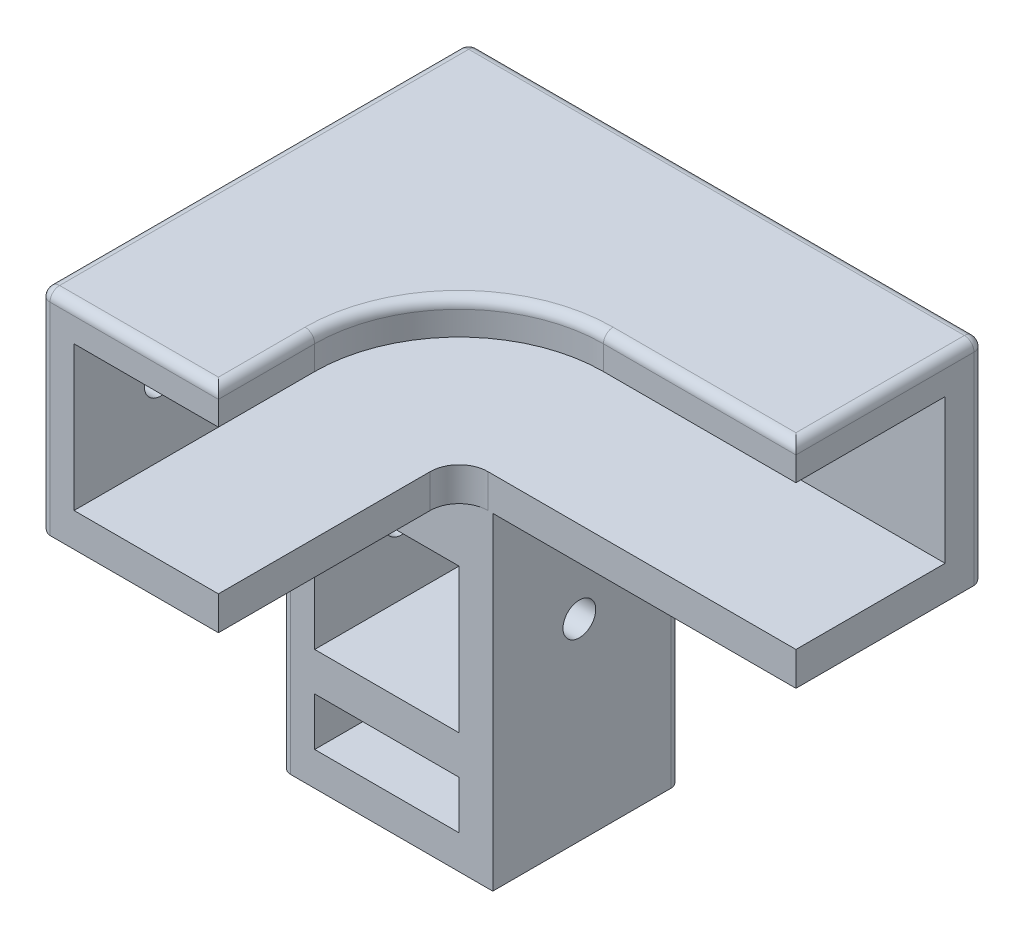
from build123d import *

# Parameters (mm, degrees)
BOSS_EXTRUDE1_DEPTH  = 19.5
SKETCH3_W            = 18.5
SKETCH3_H            = 22
BOSS_EXTRUDE2_DEPTH  = 25
SKETCH5_W            = 50
SKETCH5_H            = 15
SKETCH5_W_2          = 15
SKETCH5_H_2          = 5
CUT_EXTRUDE1_DEPTH   = 40.5
BOSS_EXTRUDE4_DEPTH  = 3.5
BOSS_EXTRUDE5_DEPTH  = 3.5
BOSS_EXTRUDE6_DEPTH  = 3.5
FILLET3_R            = 3
CUT_EXTRUDE3_DEPTH   = 1
SKETCH12_R           = 1.7
CUT_EXTRUDE4_DEPTH   = 5
SKETCH13_R           = 1.7
CUT_EXTRUDE5_DEPTH   = 45
SKETCH14_R           = 1.7
CUT_EXTRUDE6_DEPTH   = 45
SKETCH15_R           = 1.7
CUT_EXTRUDE7_DEPTH   = 4
FILLET3_OF_MIRROR2_R = 3
SKETCH16_W           = 70.294928241
SKETCH16_H           = 57.866283398
CUT_EXTRUDE8_DEPTH   = 72
FILLET4_R            = 1


with BuildPart() as part:
    # Sketch1 → Boss-Extrude1 (new body)
    with BuildSketch(Plane.XY):
        Polygon((-5.699410772, 32.916253451), (16.300589228, 32.916253451), (16.300589228, -23.083746549), (-5.699410772, -23.083746549), (-5.699410772, 10.916253451), (-37.199410772, 10.916253451), (-37.199410772, 32.916253451), align=None)
    boss_extrude1 = extrude(amount=BOSS_EXTRUDE1_DEPTH)

    # Sketch3 → Boss-Extrude2 (add)
    with BuildSketch(Plane.XY.offset(19.5)):
        with Locations((7.050589228, 21.916253451)):
            Rectangle(SKETCH3_W, SKETCH3_H)
    boss_extrude2 = extrude(amount=BOSS_EXTRUDE2_DEPTH)

    # Sketch5 → Cut-Extrude1 (cut)
    with BuildSketch(Plane.XY.offset(44.5)):
        with Locations((-12.199410772, 21.916253451)):
            Rectangle(SKETCH5_W, SKETCH5_H)
        with Locations((5.300589228, -3.083746549)):
            Rectangle(SKETCH5_W_2, SKETCH5_H)
        with Locations((5.300589228, -17.083746549)):
            Rectangle(SKETCH5_W_2, SKETCH5_H_2)
    cut_extrude1 = extrude(amount=-CUT_EXTRUDE1_DEPTH, mode=Mode.SUBTRACT)

    # Sketch7 → Boss-Extrude4 (add)
    with BuildSketch(Plane(origin=(16.300589228, 0, 0), x_dir=(0, 0, -1), z_dir=(1, 0, 0))):
        with BuildLine():
            Line((-34.5, 10.916253451), (-19.5, 10.916253451))
            Line((-19.5, 10.916253451), (-19.5, -4.083746549))
            ThreePointArc((-19.5, -4.083746549), (-23.893398282, 6.522855169), (-34.5, 10.916253451))
        make_face()
    boss_extrude4 = extrude(amount=-BOSS_EXTRUDE4_DEPTH)

    # Sketch8 → Boss-Extrude5 (add)
    with BuildSketch(Plane(origin=(0, 0, 0), x_dir=(-1, 0, 0), z_dir=(0, 0, -1))):
        with BuildLine():
            Line((5.699410772, 10.916253451), (20.699410772, 10.916253451))
            ThreePointArc((20.699410772, 10.916253451), (10.092809055, 6.522855169), (5.699410772, -4.083746549))
            Line((5.699410772, -4.083746549), (5.699410772, 10.916253451))
        make_face()
    boss_extrude5 = extrude(amount=-BOSS_EXTRUDE5_DEPTH)

    # Sketch9 → Boss-Extrude6 (add)
    with BuildSketch(Plane(origin=(0, 32.916253451, 0), x_dir=(1, 0, 0), z_dir=(0, 1, 0))):
        with BuildLine():
            Line((-2.199410772, -34.5), (-2.199410772, -19.5))
            Line((-2.199410772, -19.5), (-17.199410772, -19.5))
            ThreePointArc((-17.199410772, -19.5), (-6.592809055, -23.893398282), (-2.199410772, -34.5))
        make_face()
    boss_extrude6 = extrude(amount=-BOSS_EXTRUDE6_DEPTH)

    # Fillet3
    fillet3_edges = [part.edges().sort_by_distance(p)[0] for p in [
        (-2.199410772, 12.666253451, 19.5),
    ]]
    fillet(fillet3_edges, radius=FILLET3_R)

    # Sketch11 → Cut-Extrude3 (cut)
    # profile 1 of 4: a face of its own
    with BuildSketch(Plane(origin=(0, 0, 0), x_dir=(-1, 0, 0), z_dir=(0, 0, -1))):
        Polygon((-10.800589228, -18.789996549), (-10.800589228, -16.838073472), (-2.43039692, -14.652977318), (-10.800589228, -12.463073472), (-10.800589228, -10.515958087), (1.199410772, -8.729900395), (1.199410772, -10.602496549), (-6.379916151, -11.729900395), (1.199410772, -13.715477318), (1.199410772, -15.597688857), (-6.379916151, -17.576054241), (1.199410772, -18.703458087), (1.199410772, -20.576054241), align=None)
    # profile 2 of 4: a face of its own
    with BuildSketch(Plane(origin=(0, 0, 0), x_dir=(-1, 0, 0), z_dir=(0, 0, -1))):
        with BuildLine():
            Line((-10.800589228, -7.991438857), (-10.800589228, -5.952977318))
            add(Edge.make_bspline(
                [(-10.800589228, -5.952977318), (-10.800005012, -5.818337024), (-10.798881276, -5.559357226), (-10.780939362, -5.185841664), (-10.756194453, -4.841644627), (-10.717588986, -4.528141475), (-10.670910939, -4.244422827), (-10.610297955, -3.991812577), (-10.542991354, -3.767135176), (-10.432899575, -3.510089545), (-10.261344606, -3.2204116), (-9.993854575, -2.916502166), (-9.674999978, -2.642644015), (-9.298421338, -2.412342144), (-8.876833149, -2.221736808), (-8.412796045, -2.089022583), (-7.914245505, -2.00467731), (-7.569376461, -1.995936272), (-7.391935381, -1.991438857)],
                knots=[0, 0, 0, 0, 1.067446855, 2.053227611, 2.964447842, 3.802928181, 4.55705831, 5.242813606, 5.861740442, 6.41401137, 7.456762865, 8.515266784, 9.610284097, 10.777391769, 12.003071174, 13.267653188, 14.594160368, 16, 16, 16, 16], degree=3))
            add(Edge.make_bspline(
                [(-7.391935381, -1.991438857), (-7.297355032, -1.992855248), (-7.111944506, -1.99563187), (-6.839545611, -2.016474255), (-6.57922187, -2.056818659), (-6.329385024, -2.104637483), (-6.092864844, -2.173393793), (-5.86736032, -2.254741183), (-5.654862929, -2.353204183), (-5.453365078, -2.465039747), (-5.262464902, -2.588608019), (-5.086843378, -2.732896484), (-4.9205107, -2.888692529), (-4.766123648, -3.059365613), (-4.626046251, -3.246963608), (-4.496602326, -3.448494847), (-4.377999142, -3.665222723), (-4.310704173, -3.817832702), (-4.276550766, -3.895285011)],
                knots=[0, 0, 0, 0, 1.163181294, 2.28024169, 3.356120165, 4.401649984, 5.406013808, 6.381787017, 7.347406326, 8.282525473, 9.21452408, 10.139462981, 11.073595085, 12.01554303, 12.965498088, 13.949545959, 14.959357709, 16, 16, 16, 16], degree=3))
            Line((-4.276550766, -3.895285011), (1.199410772, -1.452977318))
            Line((1.199410772, -1.452977318), (1.199410772, -3.541919626))
            Line((1.199410772, -3.541919626), (-4.031358458, -5.873650395))
            Line((-4.031358458, -5.873650395), (-4.031358458, -6.145285011))
            Line((-4.031358458, -6.145285011), (1.199410772, -6.145285011))
            Line((1.199410772, -6.145285011), (1.199410772, -7.991438857))
            Line((1.199410772, -7.991438857), (-10.800589228, -7.991438857))
        make_face()
        with BuildLine():
            Line((-6.185204612, -6.145285011), (-6.185204612, -5.515477318))
            add(Edge.make_bspline(
                [(-6.185204612, -5.515477318), (-6.186367141, -5.438550003), (-6.188596807, -5.291007573), (-6.198784481, -5.078941418), (-6.223636793, -4.886497292), (-6.255016899, -4.712471663), (-6.291026717, -4.555276318), (-6.342625913, -4.418389599), (-6.399049431, -4.298462814), (-6.489896288, -4.166118437), (-6.633796999, -4.027471922), (-6.856716063, -3.91397639), (-7.124487444, -3.84724369), (-7.317795964, -3.840947182), (-7.420781535, -3.837592703)],
                knots=[0, 0, 0, 0, 1.14443165, 2.194958024, 3.155864406, 4.02787753, 4.825710302, 5.549708663, 6.200008757, 6.791751392, 7.929772656, 9.129352395, 10.470655706, 12, 12, 12, 12], degree=3))
            add(Edge.make_bspline(
                [(-7.420781535, -3.837592703), (-7.484265153, -3.839856392), (-7.607360624, -3.844245712), (-7.785755229, -3.879686188), (-7.952879051, -3.933201989), (-8.103735349, -4.014031264), (-8.239800846, -4.109799367), (-8.356212547, -4.223260262), (-8.450592564, -4.353040951), (-8.531146795, -4.502587927), (-8.586059735, -4.694350085), (-8.620716321, -4.939833657), (-8.644326337, -5.246603017), (-8.645891807, -5.472154526), (-8.646743074, -5.594804241)],
                knots=[0, 0, 0, 0, 0.9241003, 1.791841178, 2.640927318, 3.471185814, 4.274581995, 5.058835706, 5.827024317, 6.605084504, 7.520888769, 8.714677486, 10.213517293, 12, 12, 12, 12], degree=3))
            Line((-8.646743074, -5.594804241), (-8.646743074, -6.145285011))
            Line((-8.646743074, -6.145285011), (-6.185204612, -6.145285011))
        make_face(mode=Mode.SUBTRACT)
    # profile 3 of 4: a face of its own
    with BuildSketch(Plane(origin=(0, 0, 0), x_dir=(-1, 0, 0), z_dir=(0, 0, -1))):
        with BuildLine():
            add(Edge.make_bspline(
                [(-1.262127689, -0.176054241), (-1.257647984, -0.104101941), (-1.248753835, 0.038754448), (-1.172545764, 0.242235867), (-1.05033496, 0.427832621), (-0.88404186, 0.590235666), (-0.687299125, 0.730105266), (-0.462023761, 0.828247267), (-0.217504351, 0.891566147), (-0.046993635, 0.897708021), (0.040756926, 0.900868836)],
                knots=[0, 0, 0, 0, 0.919349048, 1.825304879, 2.744940427, 3.746623331, 4.786044724, 5.819977252, 6.878086821, 8, 8, 8, 8], degree=3))
            add(Edge.make_bspline(
                [(0.040756926, 0.900868836), (0.128481887, 0.897613897), (0.299721778, 0.891260229), (0.545324854, 0.828809783), (0.771582895, 0.729449747), (0.970335119, 0.590396057), (1.138671939, 0.427821465), (1.264004419, 0.242957175), (1.339760461, 0.038678283), (1.348736151, -0.104127453), (1.353256926, -0.176054241)],
                knots=[0, 0, 0, 0, 1.117536417, 2.181440851, 3.211339843, 4.255104211, 5.260135653, 6.181815925, 7.084237479, 8, 8, 8, 8], degree=3))
            add(Edge.make_bspline(
                [(1.353256926, -0.176054241), (1.348770157, -0.248001687), (1.339861983, -0.390848436), (1.263364391, -0.595455675), (1.139460356, -0.781986068), (0.970956709, -0.945114294), (0.77080448, -1.081189928), (0.54542444, -1.181069939), (0.299695058, -1.243328016), (0.128472836, -1.249708594), (0.040756926, -1.252977318)],
                knots=[0, 0, 0, 0, 0.915447906, 1.817559426, 2.747445231, 3.752131388, 4.789763433, 5.819308596, 6.882847519, 8, 8, 8, 8], degree=3))
            add(Edge.make_bspline(
                [(0.040756926, -1.252977318), (-0.046984438, -1.249802679), (-0.217477284, -1.243633944), (-0.462123928, -1.180506316), (-0.686511891, -1.081845741), (-0.884668075, -0.944947749), (-1.051117925, -0.781983335), (-1.171904853, -0.594743665), (-1.248854997, -0.390923093), (-1.257681869, -0.248026694), (-1.262127689, -0.176054241)],
                knots=[0, 0, 0, 0, 1.121525552, 2.179269538, 3.212844836, 4.246063491, 5.247400307, 6.175325774, 7.080968592, 8, 8, 8, 8], degree=3))
        make_face()
    # profile 4 of 4: a face of its own
    with BuildSketch(Plane(origin=(0, 0, 0), x_dir=(-1, 0, 0), z_dir=(0, 0, -1))):
        with BuildLine():
            Line((-7.877512305, 3.639330374), (-7.877512305, 1.793176528))
            add(Edge.make_bspline(
                [(-7.877512305, 1.793176528), (-7.985104597, 1.806156245), (-8.194919789, 1.831467926), (-8.50062502, 1.89307865), (-8.789725475, 1.969009097), (-9.063857289, 2.060670567), (-9.32041803, 2.168002956), (-9.560895844, 2.292709709), (-9.787587098, 2.42930416), (-9.925017131, 2.537709574), (-9.99289692, 2.591253451)],
                knots=[0, 0, 0, 0, 1.13409845, 2.211599726, 3.261451197, 4.261463951, 5.235132031, 6.169264622, 7.095758548, 8, 8, 8, 8], degree=3))
            add(Edge.make_bspline(
                [(-9.99289692, 2.591253451), (-10.082013161, 2.667910273), (-10.256359415, 2.817881026), (-10.483761061, 3.07110519), (-10.676767562, 3.337669411), (-10.835123876, 3.619879277), (-10.958228421, 3.915924445), (-11.044683072, 4.227572925), (-11.099664631, 4.553240287), (-11.10537913, 4.776126179), (-11.108281535, 4.889330374)],
                knots=[0, 0, 0, 0, 1.065406432, 2.084352066, 3.078868942, 4.045367136, 5.013203651, 5.979674514, 6.9738726, 8, 8, 8, 8], degree=3))
            add(Edge.make_bspline(
                [(-11.108281535, 4.889330374), (-11.105554752, 4.990429502), (-11.100204953, 5.188780494), (-11.056686246, 5.480236578), (-10.97985421, 5.757907044), (-10.8818086, 6.026068289), (-10.745230943, 6.277428113), (-10.587175591, 6.520140361), (-10.396186865, 6.748620977), (-10.177194209, 6.959885993), (-9.943110555, 7.156839202), (-9.690759412, 7.324416021), (-9.43059281, 7.47074821), (-9.157422302, 7.588703888), (-8.873189212, 7.680392593), (-8.578388089, 7.744054748), (-8.273858918, 7.787935844), (-8.06677444, 7.791411893), (-7.96164692, 7.793176528)],
                knots=[0, 0, 0, 0, 1.018635126, 1.998506719, 2.96030997, 3.918683232, 4.868719089, 5.836268132, 6.834011598, 7.861887245, 8.899958098, 9.91230014, 10.909978245, 11.904579616, 12.905650751, 13.91466998, 14.941371293, 16, 16, 16, 16], degree=3))
            add(Edge.make_bspline(
                [(-7.96164692, 7.793176528), (-7.831571704, 7.7882504), (-7.575267724, 7.778543815), (-7.199658116, 7.710806724), (-6.842854452, 7.593710225), (-6.50564623, 7.43251906), (-6.191993909, 7.228071619), (-5.907939838, 6.979968911), (-5.654954295, 6.689672154), (-5.517272776, 6.469896674), (-5.447223843, 6.358080374)],
                knots=[0, 0, 0, 0, 1.027701034, 2.025011931, 3.004147813, 3.986880317, 4.970346872, 5.953160964, 6.958619193, 8, 8, 8, 8], degree=3))
            add(Edge.make_bspline(
                [(-5.447223843, 6.358080374), (-5.418934484, 6.430798423), (-5.362819656, 6.575042087), (-5.255412748, 6.779194324), (-5.134751997, 6.973329501), (-4.999067172, 7.154540458), (-4.847347238, 7.322970358), (-4.681616094, 7.478791827), (-4.500395305, 7.624150933), (-4.30375287, 7.755244697), (-4.095176448, 7.873355347), (-3.875726079, 7.97347104), (-3.648685489, 8.060719415), (-3.412791492, 8.133216192), (-3.166864793, 8.188590605), (-2.911254324, 8.225884056), (-2.647259211, 8.251365722), (-2.468118928, 8.253589988), (-2.377512305, 8.254714989)],
                knots=[0, 0, 0, 0, 0.971157749, 1.926390409, 2.867917292, 3.816032967, 4.741824403, 5.6878893, 6.646452846, 7.631864642, 8.628382992, 9.628642509, 10.633224323, 11.656081692, 12.699617594, 13.76949873, 14.871843985, 16, 16, 16, 16], degree=3))
            add(Edge.make_bspline(
                [(-2.377512305, 8.254714989), (-2.244325252, 8.252503818), (-1.981850533, 8.248146212), (-1.597044081, 8.197009582), (-1.226862615, 8.122689872), (-0.874542963, 8.009706698), (-0.536107314, 7.870492658), (-0.212201339, 7.699845341), (0.092892066, 7.493753909), (0.380575775, 7.261849568), (0.643411265, 7.006428676), (0.8765742, 6.732895346), (1.069672671, 6.437585756), (1.23223783, 6.128720843), (1.355158488, 5.799574581), (1.443839147, 5.455657192), (1.498563993, 5.093806224), (1.504216675, 4.847057422), (1.50710308, 4.721061143)],
                knots=[0, 0, 0, 0, 1.08934669, 2.146800001, 3.171892192, 4.175766193, 5.1695646, 6.164076811, 7.166278581, 8.178196077, 9.184573215, 10.16196427, 11.113242845, 12.066531174, 13.012937118, 13.981620827, 14.969363733, 16, 16, 16, 16], degree=3))
            add(Edge.make_bspline(
                [(1.50710308, 4.721061143), (1.504031919, 4.602279119), (1.498005885, 4.36921268), (1.44571629, 4.02762683), (1.362713421, 3.702437153), (1.243881772, 3.394298005), (1.091092441, 3.104692046), (0.906771997, 2.829859086), (0.687442467, 2.57259779), (0.434322499, 2.3350891), (0.15282569, 2.119255522), (-0.153407037, 1.926340908), (-0.483775783, 1.75924538), (-0.840338868, 1.624378739), (-1.217591782, 1.506817115), (-1.621739126, 1.421885121), (-2.049128635, 1.361769677), (-2.342880764, 1.341824077), (-2.49289692, 1.331638066)],
                knots=[0, 0, 0, 0, 0.974003266, 1.911126485, 2.827923683, 3.722775623, 4.613731572, 5.50894563, 6.432318302, 7.38099101, 8.351349308, 9.338047726, 10.346428225, 11.382873954, 12.462111462, 13.585146545, 14.766759469, 16, 16, 16, 16], degree=3))
            Line((-2.49289692, 1.331638066), (-2.49289692, 3.177791913))
            add(Edge.make_bspline(
                [(-2.49289692, 3.177791913), (-2.417425318, 3.188945376), (-2.270574462, 3.210647521), (-2.058705359, 3.256683558), (-1.861732034, 3.311165199), (-1.680044741, 3.376135049), (-1.514279405, 3.45120486), (-1.360798784, 3.532148117), (-1.223710633, 3.625749249), (-1.065384613, 3.762941693), (-0.896220111, 3.953356149), (-0.749458771, 4.217045491), (-0.662515335, 4.51137642), (-0.652102457, 4.7164657), (-0.646743074, 4.822022682)],
                knots=[0, 0, 0, 0, 1.004083628, 1.953722164, 2.852062002, 3.692886634, 4.490800013, 5.245942238, 5.974461452, 6.670088602, 8.000762069, 9.303976857, 10.612389357, 12, 12, 12, 12], degree=3))
            add(Edge.make_bspline(
                [(-0.646743074, 4.822022682), (-0.647864371, 4.878202331), (-0.650053976, 4.987906785), (-0.675076379, 5.149181645), (-0.716357012, 5.302683497), (-0.770574005, 5.45033855), (-0.844338553, 5.58810378), (-0.931901508, 5.719433893), (-1.034609515, 5.844770146), (-1.195110626, 5.995917646), (-1.416786421, 6.163242766), (-1.719322479, 6.30573827), (-2.050588673, 6.3928176), (-2.280814454, 6.403216349), (-2.39914692, 6.408561143)],
                knots=[0, 0, 0, 0, 0.766703657, 1.497175717, 2.221804895, 2.935192376, 3.640052165, 4.350243223, 5.088623085, 5.847082799, 7.357237736, 8.859920549, 10.386048059, 12, 12, 12, 12], degree=3))
            add(Edge.make_bspline(
                [(-2.39914692, 6.408561143), (-2.464945748, 6.406711942), (-2.594787133, 6.403062896), (-2.786195597, 6.374088866), (-2.969648465, 6.322755274), (-3.145763747, 6.253440485), (-3.312932079, 6.163011753), (-3.473227413, 6.054384045), (-3.62413007, 5.923172242), (-3.768170684, 5.775714059), (-3.898710135, 5.608114668), (-4.014720541, 5.423570124), (-4.109640596, 5.219059789), (-4.193220285, 4.999736952), (-4.254214347, 4.760765565), (-4.29872396, 4.505093902), (-4.332010414, 4.232310528), (-4.336655471, 4.044084373), (-4.339050766, 3.947022682)],
                knots=[0, 0, 0, 0, 0.899536996, 1.775063972, 2.638995881, 3.499655969, 4.357521698, 5.232774386, 6.141935922, 7.087285127, 8.047315231, 9.041502366, 10.060909586, 11.125312509, 12.246833879, 13.426779274, 14.673079445, 16, 16, 16, 16], degree=3))
            Line((-4.339050766, 3.947022682), (-6.339050766, 3.947022682))
            add(Edge.make_bspline(
                [(-6.339050766, 3.947022682), (-6.351211097, 4.070597942), (-6.374042407, 4.302613426), (-6.427589871, 4.624478183), (-6.497441604, 4.896812425), (-6.588065699, 5.121571579), (-6.694964612, 5.310796304), (-6.816990742, 5.474794656), (-6.9584857, 5.616776513), (-7.116669669, 5.733391795), (-7.285211073, 5.826558536), (-7.45907096, 5.899690982), (-7.641166228, 5.937102036), (-7.763594277, 5.943722311), (-7.824627689, 5.947022682)],
                knots=[0, 0, 0, 0, 1.613490305, 3.029366345, 4.236845818, 5.259854129, 6.169213254, 7.054399038, 7.908596932, 8.76463379, 9.599115534, 10.407455461, 11.206077139, 12, 12, 12, 12], degree=3))
            add(Edge.make_bspline(
                [(-7.824627689, 5.947022682), (-7.902708499, 5.94339984), (-8.054533682, 5.93635536), (-8.271474473, 5.879601033), (-8.4685132, 5.787571995), (-8.638517306, 5.657006158), (-8.780104567, 5.497937744), (-8.882578523, 5.311699797), (-8.945232074, 5.101614866), (-8.951293618, 4.953882443), (-8.954435381, 4.877311143)],
                knots=[0, 0, 0, 0, 1.073009827, 2.08642706, 3.062829201, 4.046239177, 5.014892964, 5.972187552, 6.948963055, 8, 8, 8, 8], degree=3))
            add(Edge.make_bspline(
                [(-8.954435381, 4.877311143), (-8.95071032, 4.808009077), (-8.94335375, 4.671145417), (-8.884755184, 4.47123759), (-8.789639268, 4.281474968), (-8.656940841, 4.105904867), (-8.497545942, 3.947245812), (-8.310497414, 3.816432348), (-8.104113715, 3.708690565), (-7.953735758, 3.662661532), (-7.877512305, 3.639330374)],
                knots=[0, 0, 0, 0, 0.942455657, 1.861242209, 2.81281304, 3.818879151, 4.845099048, 5.862404497, 6.916497371, 8, 8, 8, 8], degree=3))
        make_face()
    extrude(amount=-CUT_EXTRUDE3_DEPTH, mode=Mode.SUBTRACT)

    # Sketch12 → Cut-Extrude4 (cut)
    with BuildSketch(Plane(origin=(0, 0, 0), x_dir=(-1, 0, 0), z_dir=(0, 0, -1))):
        with Locations((-5.300589228, 21.916253451)):
            Circle(SKETCH12_R)
        with Locations((10.949410772, 21.916253451)):
            Circle(SKETCH12_R)
        with Locations((27.199410772, 21.916253451)):
            Circle(SKETCH12_R)
    cut_extrude4 = extrude(amount=-CUT_EXTRUDE4_DEPTH, mode=Mode.SUBTRACT)

    # Sketch13 → Cut-Extrude5 (cut)
    with BuildSketch(Plane.ZY.offset(5.699410772)):
        with Locations(Location((10.5, -3.083746549, 0), (0, 0, 270))):
            Circle(SKETCH13_R)
    cut_extrude5 = extrude(amount=-CUT_EXTRUDE5_DEPTH, mode=Mode.SUBTRACT)

    # Sketch14 → Cut-Extrude6 (cut)
    with BuildSketch(Plane(origin=(16.300589228, 0, 0), x_dir=(0, 0, -1), z_dir=(1, 0, 0))):
        with Locations(Location((-10.5, 21.916253451, 0), (0, 0, 90))):
            Circle(SKETCH14_R)
        with Locations(Location((-35.5, 21.916253451, 0), (0, 0, 90))):
            Circle(SKETCH14_R)
    cut_extrude6 = extrude(amount=-CUT_EXTRUDE6_DEPTH, mode=Mode.SUBTRACT)

    # Sketch15 → Cut-Extrude7 (cut)
    with BuildSketch(Plane.XZ.offset(23.083746549)):
        with Locations(Location((5.300589228, 9.75, 0), (0, 0, 270))):
            Circle(SKETCH15_R)
    cut_extrude7 = extrude(amount=-CUT_EXTRUDE7_DEPTH, mode=Mode.SUBTRACT)

    # Mirror2: Boss-Extrude1, Boss-Extrude2, Cut-Extrude1, Boss-Extrude4, Boss-Extrude5, Boss-Extrude6, Cut-Extrude4, Cut-Extrude5, Cut-Extrude6, Cut-Extrude7 across plane
    add(boss_extrude1.mirror(Plane(origin=(16.300589228, 32.916253451, 19.5), x_dir=(0, 0, 1), z_dir=(-1, 0, 0))))
    add(boss_extrude2.mirror(Plane(origin=(16.300589228, 32.916253451, 19.5), x_dir=(0, 0, 1), z_dir=(-1, 0, 0))))
    add(cut_extrude1.mirror(Plane(origin=(16.300589228, 32.916253451, 19.5), x_dir=(0, 0, 1), z_dir=(-1, 0, 0))), mode=Mode.SUBTRACT)
    add(boss_extrude4.mirror(Plane(origin=(16.300589228, 32.916253451, 19.5), x_dir=(0, 0, 1), z_dir=(-1, 0, 0))))
    add(boss_extrude5.mirror(Plane(origin=(16.300589228, 32.916253451, 19.5), x_dir=(0, 0, 1), z_dir=(-1, 0, 0))))
    add(boss_extrude6.mirror(Plane(origin=(16.300589228, 32.916253451, 19.5), x_dir=(0, 0, 1), z_dir=(-1, 0, 0))))
    add(cut_extrude4.mirror(Plane(origin=(16.300589228, 32.916253451, 19.5), x_dir=(0, 0, 1), z_dir=(-1, 0, 0))), mode=Mode.SUBTRACT)
    add(cut_extrude5.mirror(Plane(origin=(16.300589228, 32.916253451, 19.5), x_dir=(0, 0, 1), z_dir=(-1, 0, 0))), mode=Mode.SUBTRACT)
    add(cut_extrude6.mirror(Plane(origin=(16.300589228, 32.916253451, 19.5), x_dir=(0, 0, 1), z_dir=(-1, 0, 0))), mode=Mode.SUBTRACT)
    add(cut_extrude7.mirror(Plane(origin=(16.300589228, 32.916253451, 19.5), x_dir=(0, 0, 1), z_dir=(-1, 0, 0))), mode=Mode.SUBTRACT)

    # Fillet3 of Mirror2
    fillet3_of_mirror2_edges = [part.edges().sort_by_distance(p)[0] for p in [
        (34.800589228, 12.666253451, 19.5),
    ]]
    fillet(fillet3_of_mirror2_edges, radius=FILLET3_OF_MIRROR2_R)

    # Sketch16 → Cut-Extrude8 (cut)
    with BuildSketch(Plane(origin=(0, 0, 0), x_dir=(-1, 0, 0), z_dir=(0, 0, -1))):
        with Locations((18.846874893, 3.983111752)):
            Rectangle(SKETCH16_W, SKETCH16_H)
    extrude(amount=-CUT_EXTRUDE8_DEPTH, mode=Mode.SUBTRACT)

    # Fillet4
    fillet4_edges = [part.edges().sort_by_distance(p)[0] for p in [
        (25.550589228, 32.916253451, 44.5),
        (69.800589228, 32.916253451, 9.75),
        (69.800589228, 21.916253451, 0),
        (61.550589228, 10.916253451, 0),
        (34.800589228, 32.916253451, 39.5),
        (38.300589228, -13.583746549, 0),
        (42.69398751, 6.522855169, 0),
        (59.800589228, 32.916253451, 19.5),
        (39.19398751, 32.916253451, 23.893398282),
        (16.300589228, 32.916253451, 22.25),
        (16.300589228, 4.916253451, 0),
        (16.300589228, 21.916253451, 44.5),
        (16.300589228, 10.916253451, 39.5),
        (16.300589228, -13.583746549, 19.5),
        (16.300589228, 6.522855169, 23.893398282),
        (43.050589228, 32.916253451, 0),
    ]]
    fillet(fillet4_edges, radius=FILLET4_R)


solid = part.part
